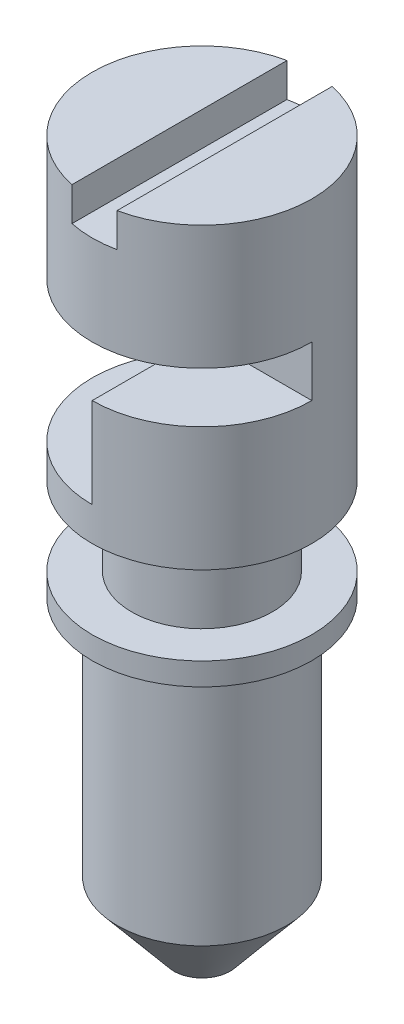
from build123d import *

# Parameters (mm, degrees)
BASES_R              = 1.95
BASE_DEPTH           = 5.3
SCREWSLOTS_W         = 0.8
SCREWSLOTS_H         = 3.9
SCREWSLOT_DEPTH      = 0.6
MAINSLOT_DEPTH       = 6.97452927
MAINSLOT_DEPTH_BACK  = 6.97452927
MAINSLOTS_W          = 1.95
MAINSLOTS_H          = 2.5
SMALLSLOT_DEPTH      = 6.97452927
SMALLSLOT_DEPTH_BACK = 6.97452927
SMALLSLOTS_W         = 1.95
SMALLSLOTS_H         = 0.9


with BuildPart() as part:
    # BaseS → Base (new body)
    with BuildSketch(Plane(origin=(0, 0, 0), x_dir=(1, 0, 0), z_dir=(0, 1, 0))):
        Circle(BASES_R)
    extrude(amount=BASE_DEPTH)

    # ScrewSlotS → ScrewSlot (cut)
    with BuildSketch(Plane(origin=(0, 5.3, 0), x_dir=(1, 0, 0), z_dir=(0, 1, 0))):
        Rectangle(SCREWSLOTS_W, SCREWSLOTS_H)
    extrude(amount=-SCREWSLOT_DEPTH, mode=Mode.SUBTRACT)

    # MainSlotS → MainSlot (cut, two sides: drawn at the far end of the back side and taken through both)
    with BuildSketch(Plane.XY.offset(-MAINSLOT_DEPTH_BACK)):
        with Locations((-0.975, 1.85)):
            Rectangle(MAINSLOTS_W, MAINSLOTS_H)
    extrude(amount=MAINSLOT_DEPTH + MAINSLOT_DEPTH_BACK, mode=Mode.SUBTRACT)

    # SmallSlotS → SmallSlot (cut, two sides: drawn at the far end of the back side and taken through both)
    with BuildSketch(Plane(origin=(0, 0, 0), x_dir=(0, 0, -1), z_dir=(1, 0, 0)).offset(-SMALLSLOT_DEPTH_BACK)):
        with Locations((-0.975, 2.65)):
            Rectangle(SMALLSLOTS_W, SMALLSLOTS_H)
    extrude(amount=SMALLSLOT_DEPTH + SMALLSLOT_DEPTH_BACK, mode=Mode.SUBTRACT)

    # O-RingBodyS → O-RingBody (revolve)
    with BuildSketch(Plane.XY):
        Polygon((-1.25, 0), (0, 0), (0, -7.3), (-0.5, -7.3), (-1.5, -6.1), (-1.5, -1.8), (-1.95, -1.8), (-1.95, -1.4), (-1.25, -1.4), align=None)
    revolve(axis=Axis((0, 0, 0), (0, -1, 0)))


solid = part.part
